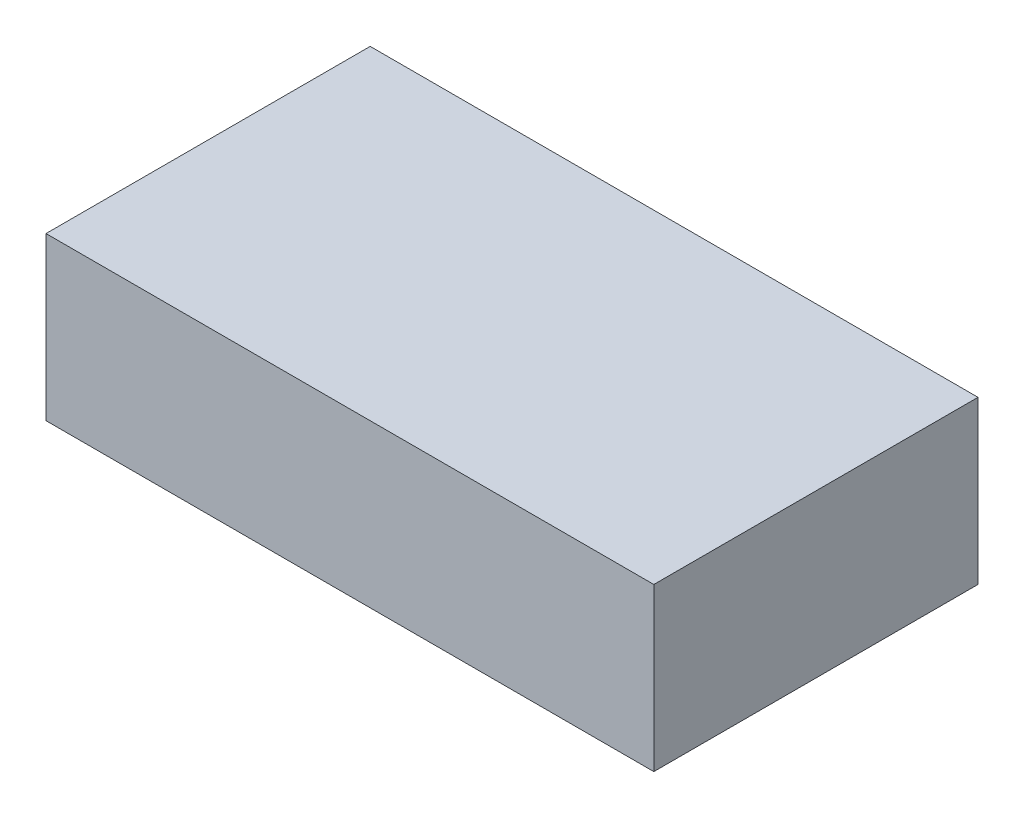
from build123d import *

# Parameters (mm, degrees)
SKETCH1_W           = 304.8
SKETCH1_H           = 304.8
BOSS_EXTRUDE1_DEPTH = 6.35
CUT_EXTRUDE2_DEPTH  = 6.35


with BuildPart() as part:
    # Sketch1 → Boss-Extrude1 (new body)
    with BuildSketch(Plane(origin=(0, 0, 0), x_dir=(1, 0, 0), z_dir=(0, 1, 0))):
        with Locations((152.4, 152.4)):
            Rectangle(SKETCH1_W, SKETCH1_H)
    extrude(amount=BOSS_EXTRUDE1_DEPTH)

    # Sketch2 → Cut-Extrude2 (cut)
    with BuildSketch(Plane(origin=(0, 6.35, 0), x_dir=(1, 0, 0), z_dir=(0, 1, 0))):
        Polygon((23.8125, 304.8), (23.8125, 292.1), (0, 292.1), (0, 0), (304.8, 0), (304.8, 304.8), align=None)
    extrude(amount=-CUT_EXTRUDE2_DEPTH, mode=Mode.SUBTRACT)


solid = part.part
